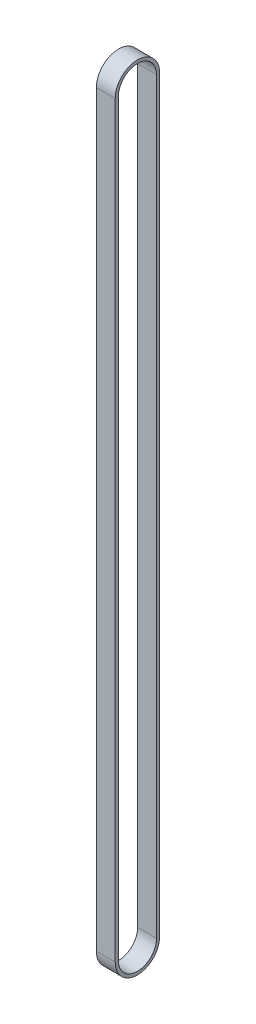
from build123d import *

# Parameters (mm, degrees)
BOSS_EXTRUDE1_DEPTH = 6.05


with BuildPart() as part:
    # Sketch1 → Boss-Extrude1 (new body)
    with BuildSketch(Plane.YZ):
        with BuildLine():
            Line((-120, 7.125), (120, 7.125))
            ThreePointArc((120, 7.125), (127.125, 0), (120, -7.125))
            Line((120, -7.125), (-120, -7.125))
            ThreePointArc((-120, -7.125), (-127.125, 0), (-120, 7.125))
        make_face()
        with BuildLine():
            Line((-120, 6.125), (120, 6.125))
            ThreePointArc((120, 6.125), (126.125, 0), (120, -6.125))
            Line((120, -6.125), (-120, -6.125))
            ThreePointArc((-120, -6.125), (-126.125, 0), (-120, 6.125))
        make_face(mode=Mode.SUBTRACT)
    extrude(amount=BOSS_EXTRUDE1_DEPTH)


solid = part.part
